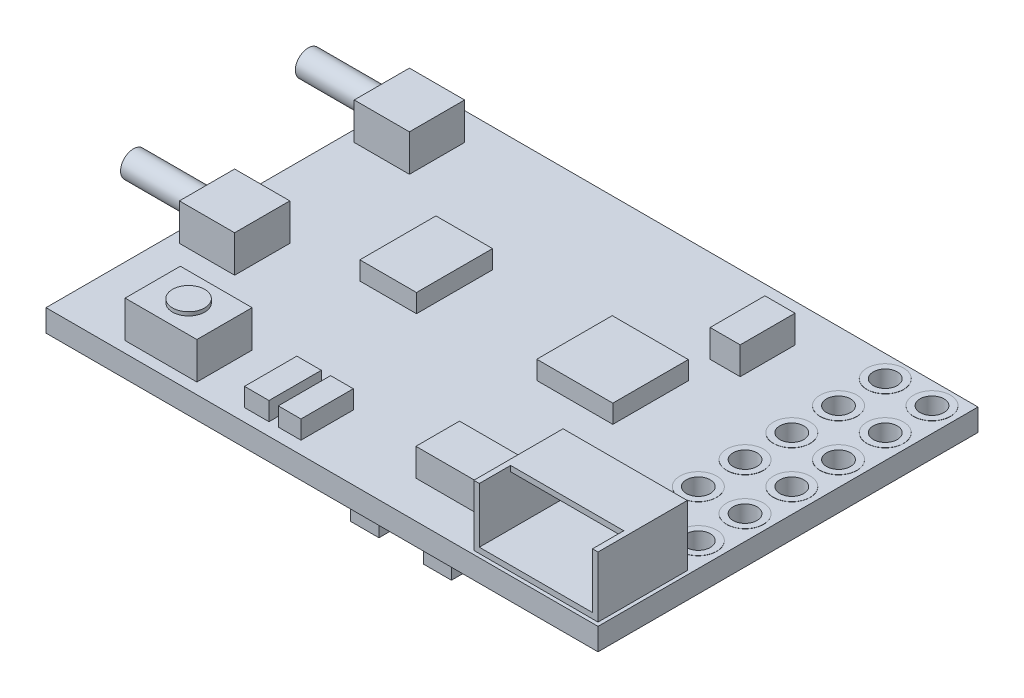
from build123d import *

# Parameters (mm, degrees)
SKETCH1_W            = 30
SKETCH1_H            = 20.65
BOSS_EXTRUDE1_DEPTH  = 1.2
CUT_EXTRUDE1_REACH   = 20.25
SKETCH2_R            = 0.65
SKETCH3_W            = 6.75
SKETCH3_H            = 4.85
BOSS_EXTRUDE2_DEPTH  = 3.3
SKETCH7_W            = 6.15
SKETCH7_H            = 1.7
CUT_EXTRUDE2_DEPTH   = 3
SKETCH8_W            = 6.15
SKETCH8_H            = 2.7
CUT_EXTRUDE3_DEPTH   = 2.85
SKETCH4_W            = 3
SKETCH4_H            = 3
BOSS_EXTRUDE3_DEPTH  = 2
SKETCH5_W            = 3.9
SKETCH5_H            = 3
BOSS_EXTRUDE4_DEPTH  = 2
SKETCH6_R            = 0.875
BOSS_EXTRUDE5_DEPTH  = 0.2
SKETCH9_W            = 4.13358082
SKETCH9_H            = 4.101537558
SKETCH9_W_2          = 3.076153169
SKETCH9_H_2          = 4.13358082
SKETCH9_W_3          = 1.33120833
SKETCH9_H_3          = 2.844230124
SKETCH9_W_4          = 1.23295523
BOSS_EXTRUDE6_DEPTH  = 1
SKETCH10_W           = 1.634206371
SKETCH10_H           = 2.980023382
SKETCH10_W_2         = 4.454013442
SKETCH10_H_2         = 2.371201401
BOSS_EXTRUDE7_DEPTH  = 1.5
SKETCH11_W           = 6.849678862
SKETCH11_H           = 6.849678863
SKETCH11_W_2         = 1.518707079
SKETCH11_H_2         = 3.006420134
SKETCH11_W_3         = 1.5497011
SKETCH11_H_3         = 3.068408178
SKETCH11_W_4         = 1.177772837
SKETCH11_H_4         = 2.758467958
SKETCH11_W_5         = 2.86022906
SKETCH11_H_5         = 4.18419297
SKETCH11_W_6         = 2.386539694
SKETCH11_H_6         = 3.0994022
SKETCH11_W_7         = 1.270754903
SKETCH11_H_7         = 3.161390244
BOSS_EXTRUDE8_DEPTH  = 1.5
BOSS_EXTRUDE9_START  = 0.01
SKETCH12_R           = 1
SKETCH12_R_2         = 0.65
BOSS_EXTRUDE9_DEPTH  = 0.01
SKETCH13_R           = 0.7
BOSS_EXTRUDE10_DEPTH = 4


with BuildPart() as part:
    # Sketch1 → Boss-Extrude1 (new body)
    with BuildSketch(Plane(origin=(0, 0, 0), x_dir=(1, 0, 0), z_dir=(0, 1, 0))):
        Rectangle(SKETCH1_W, SKETCH1_H)
    extrude(amount=BOSS_EXTRUDE1_DEPTH)

    # Sketch2 → Cut-Extrude1 (cut, up to next)
    with BuildSketch(Plane(origin=(0, 1.2, 0), x_dir=(1, 0, 0), z_dir=(0, 1, 0)), mode=Mode.PRIVATE) as cut_extrude1_sk1:
        with Locations(Location((13.7, 9.125, 0), (0, 0, 270))):
            Circle(SKETCH2_R)
    cut_extrude1_tool1 = extrude(cut_extrude1_sk1.sketch, amount=-CUT_EXTRUDE1_REACH, mode=Mode.PRIVATE) & part.part
    # Sketch2 → Cut-Extrude1 (cut, up to next)
    with BuildSketch(Plane(origin=(0, 1.2, 0), x_dir=(1, 0, 0), z_dir=(0, 1, 0)), mode=Mode.PRIVATE) as cut_extrude1_sk2:
        with Locations(Location((11.16, 9.125, 0), (0, 0, 270))):
            Circle(SKETCH2_R)
    cut_extrude1_tool2 = extrude(cut_extrude1_sk2.sketch, amount=-CUT_EXTRUDE1_REACH, mode=Mode.PRIVATE) & part.part
    # Sketch2 → Cut-Extrude1 (cut, up to next)
    with BuildSketch(Plane(origin=(0, 1.2, 0), x_dir=(1, 0, 0), z_dir=(0, 1, 0)), mode=Mode.PRIVATE) as cut_extrude1_sk3:
        with Locations(Location((11.16, 6.585, 0), (0, 0, 270))):
            Circle(SKETCH2_R)
    cut_extrude1_tool3 = extrude(cut_extrude1_sk3.sketch, amount=-CUT_EXTRUDE1_REACH, mode=Mode.PRIVATE) & part.part
    # Sketch2 → Cut-Extrude1 (cut, up to next)
    with BuildSketch(Plane(origin=(0, 1.2, 0), x_dir=(1, 0, 0), z_dir=(0, 1, 0)), mode=Mode.PRIVATE) as cut_extrude1_sk4:
        with Locations(Location((11.16, 4.045, 0), (0, 0, 270))):
            Circle(SKETCH2_R)
    cut_extrude1_tool4 = extrude(cut_extrude1_sk4.sketch, amount=-CUT_EXTRUDE1_REACH, mode=Mode.PRIVATE) & part.part
    # Sketch2 → Cut-Extrude1 (cut, up to next)
    with BuildSketch(Plane(origin=(0, 1.2, 0), x_dir=(1, 0, 0), z_dir=(0, 1, 0)), mode=Mode.PRIVATE) as cut_extrude1_sk5:
        with Locations(Location((11.16, 1.505, 0), (0, 0, 270))):
            Circle(SKETCH2_R)
    cut_extrude1_tool5 = extrude(cut_extrude1_sk5.sketch, amount=-CUT_EXTRUDE1_REACH, mode=Mode.PRIVATE) & part.part
    # Sketch2 → Cut-Extrude1 (cut, up to next)
    with BuildSketch(Plane(origin=(0, 1.2, 0), x_dir=(1, 0, 0), z_dir=(0, 1, 0)), mode=Mode.PRIVATE) as cut_extrude1_sk6:
        with Locations(Location((11.16, -1.035, 0), (0, 0, 270))):
            Circle(SKETCH2_R)
    cut_extrude1_tool6 = extrude(cut_extrude1_sk6.sketch, amount=-CUT_EXTRUDE1_REACH, mode=Mode.PRIVATE) & part.part
    # Sketch2 → Cut-Extrude1 (cut, up to next)
    with BuildSketch(Plane(origin=(0, 1.2, 0), x_dir=(1, 0, 0), z_dir=(0, 1, 0)), mode=Mode.PRIVATE) as cut_extrude1_sk7:
        with Locations(Location((11.16, -3.575, 0), (0, 0, 270))):
            Circle(SKETCH2_R)
    cut_extrude1_tool7 = extrude(cut_extrude1_sk7.sketch, amount=-CUT_EXTRUDE1_REACH, mode=Mode.PRIVATE) & part.part
    # Sketch2 → Cut-Extrude1 (cut, up to next)
    with BuildSketch(Plane(origin=(0, 1.2, 0), x_dir=(1, 0, 0), z_dir=(0, 1, 0)), mode=Mode.PRIVATE) as cut_extrude1_sk8:
        with Locations(Location((13.7, 6.585, 0), (0, 0, 270))):
            Circle(SKETCH2_R)
    cut_extrude1_tool8 = extrude(cut_extrude1_sk8.sketch, amount=-CUT_EXTRUDE1_REACH, mode=Mode.PRIVATE) & part.part
    # Sketch2 → Cut-Extrude1 (cut, up to next)
    with BuildSketch(Plane(origin=(0, 1.2, 0), x_dir=(1, 0, 0), z_dir=(0, 1, 0)), mode=Mode.PRIVATE) as cut_extrude1_sk9:
        with Locations(Location((13.7, 4.045, 0), (0, 0, 270))):
            Circle(SKETCH2_R)
    cut_extrude1_tool9 = extrude(cut_extrude1_sk9.sketch, amount=-CUT_EXTRUDE1_REACH, mode=Mode.PRIVATE) & part.part
    # Sketch2 → Cut-Extrude1 (cut, up to next)
    with BuildSketch(Plane(origin=(0, 1.2, 0), x_dir=(1, 0, 0), z_dir=(0, 1, 0)), mode=Mode.PRIVATE) as cut_extrude1_sk10:
        with Locations(Location((13.7, 1.505, 0), (0, 0, 270))):
            Circle(SKETCH2_R)
    cut_extrude1_tool10 = extrude(cut_extrude1_sk10.sketch, amount=-CUT_EXTRUDE1_REACH, mode=Mode.PRIVATE) & part.part
    # Sketch2 → Cut-Extrude1 (cut, up to next)
    with BuildSketch(Plane(origin=(0, 1.2, 0), x_dir=(1, 0, 0), z_dir=(0, 1, 0)), mode=Mode.PRIVATE) as cut_extrude1_sk11:
        with Locations(Location((13.7, -1.035, 0), (0, 0, 270))):
            Circle(SKETCH2_R)
    cut_extrude1_tool11 = extrude(cut_extrude1_sk11.sketch, amount=-CUT_EXTRUDE1_REACH, mode=Mode.PRIVATE) & part.part
    # Sketch2 → Cut-Extrude1 (cut, up to next)
    with BuildSketch(Plane(origin=(0, 1.2, 0), x_dir=(1, 0, 0), z_dir=(0, 1, 0)), mode=Mode.PRIVATE) as cut_extrude1_sk12:
        with Locations(Location((13.7, -3.575, 0), (0, 0, 270))):
            Circle(SKETCH2_R)
    cut_extrude1_tool12 = extrude(cut_extrude1_sk12.sketch, amount=-CUT_EXTRUDE1_REACH, mode=Mode.PRIVATE) & part.part
    add(cut_extrude1_tool1.solids().sort_by_distance((13.7, 1.2, -9.125))[0], mode=Mode.SUBTRACT)
    add(cut_extrude1_tool2.solids().sort_by_distance((11.16, 1.2, -9.125))[0], mode=Mode.SUBTRACT)
    add(cut_extrude1_tool3.solids().sort_by_distance((11.16, 1.2, -6.585))[0], mode=Mode.SUBTRACT)
    add(cut_extrude1_tool4.solids().sort_by_distance((11.16, 1.2, -4.045))[0], mode=Mode.SUBTRACT)
    add(cut_extrude1_tool5.solids().sort_by_distance((11.16, 1.2, -1.505))[0], mode=Mode.SUBTRACT)
    add(cut_extrude1_tool6.solids().sort_by_distance((11.16, 1.2, 1.035))[0], mode=Mode.SUBTRACT)
    add(cut_extrude1_tool7.solids().sort_by_distance((11.16, 1.2, 3.575))[0], mode=Mode.SUBTRACT)
    add(cut_extrude1_tool8.solids().sort_by_distance((13.7, 1.2, -6.585))[0], mode=Mode.SUBTRACT)
    add(cut_extrude1_tool9.solids().sort_by_distance((13.7, 1.2, -4.045))[0], mode=Mode.SUBTRACT)
    add(cut_extrude1_tool10.solids().sort_by_distance((13.7, 1.2, -1.505))[0], mode=Mode.SUBTRACT)
    add(cut_extrude1_tool11.solids().sort_by_distance((13.7, 1.2, 1.035))[0], mode=Mode.SUBTRACT)
    add(cut_extrude1_tool12.solids().sort_by_distance((13.7, 1.2, 3.575))[0], mode=Mode.SUBTRACT)

    # Sketch3 → Boss-Extrude2 (add)
    with BuildSketch(Plane(origin=(0, 1.2, 0), x_dir=(1, 0, 0), z_dir=(0, 1, 0))):
        with Locations((11.425, -7.7)):
            Rectangle(SKETCH3_W, SKETCH3_H)
    extrude(amount=BOSS_EXTRUDE2_DEPTH)

    # Sketch7 → Cut-Extrude2 (cut)
    with BuildSketch(Plane(origin=(0, 4.5, 0), x_dir=(1, 0, 0), z_dir=(0, 1, 0))):
        with Locations((11.425, -9.275)):
            Rectangle(SKETCH7_W, SKETCH7_H)
    extrude(amount=-CUT_EXTRUDE2_DEPTH, mode=Mode.SUBTRACT)

    # Sketch8 → Cut-Extrude3 (cut)
    with BuildSketch(Plane.XY.offset(8.425)):
        with Locations((11.425, 2.85)):
            Rectangle(SKETCH8_W, SKETCH8_H)
    extrude(amount=-CUT_EXTRUDE3_DEPTH, mode=Mode.SUBTRACT)

    # Sketch4 → Boss-Extrude3 (add)
    with BuildSketch(Plane(origin=(0, 1.2, 0), x_dir=(1, 0, 0), z_dir=(0, 1, 0))):
        with Locations((-12.9, 7.325)):
            Rectangle(SKETCH4_W, SKETCH4_H)
        with Locations((-12.9, -2.175)):
            Rectangle(SKETCH4_W, SKETCH4_H)
    extrude(amount=BOSS_EXTRUDE3_DEPTH)

    # Sketch5 → Boss-Extrude4 (add)
    with BuildSketch(Plane(origin=(0, 1.2, 0), x_dir=(1, 0, 0), z_dir=(0, 1, 0))):
        with Locations((-9.35, -8.225)):
            Rectangle(SKETCH5_W, SKETCH5_H)
    extrude(amount=BOSS_EXTRUDE4_DEPTH)

    # Sketch6 → Boss-Extrude5 (add)
    with BuildSketch(Plane(origin=(0, 3.2, 0), x_dir=(1, 0, 0), z_dir=(0, 1, 0))):
        with Locations(Location((-9.35, -8.225, 0), (0, 0, 90))):
            Circle(SKETCH6_R)
    extrude(amount=BOSS_EXTRUDE5_DEPTH)

    # Sketch9 → Boss-Extrude6 (add)
    with BuildSketch(Plane(origin=(0, 1.2, 0), x_dir=(1, 0, 0), z_dir=(0, 1, 0))):
        with Locations((3.82916983, 1.634206371)):
            Rectangle(SKETCH9_W, SKETCH9_H)
        with Locations((-6.1843496, 1.522054953)):
            Rectangle(SKETCH9_W_2, SKETCH9_H_2)
        with Locations((-4.237222614, -8.213349425)):
            Rectangle(SKETCH9_W_3, SKETCH9_H_3)
        with Locations((-2.449488873, -8.213349425)):
            Rectangle(SKETCH9_W_4, SKETCH9_H_3)
    extrude(amount=BOSS_EXTRUDE6_DEPTH)

    # Sketch10 → Boss-Extrude7 (add)
    with BuildSketch(Plane(origin=(0, 1.2, 0), x_dir=(1, 0, 0), z_dir=(0, 1, 0))):
        with Locations((6.296501018, 6.77714995)):
            Rectangle(SKETCH10_W, SKETCH10_H)
        with Locations((5.30315989, -7.113604202)):
            Rectangle(SKETCH10_W_2, SKETCH10_H_2)
    extrude(amount=BOSS_EXTRUDE7_DEPTH)

    # Sketch11 → Boss-Extrude8 (add)
    with BuildSketch(Plane.XZ):
        with Locations((-2.928935079, -0.803882292)):
            Rectangle(SKETCH11_W, SKETCH11_H)
        with Locations((5.387348503, 7.936431913)):
            Rectangle(SKETCH11_W_2, SKETCH11_H_2)
        with Locations((1.404616675, 7.874443869)):
            Rectangle(SKETCH11_W_3, SKETCH11_H_3)
        with Locations((5.557815623, 4.248143295)):
            Rectangle(SKETCH11_W_4, SKETCH11_H_4)
        with Locations((-13.56988547, -6.475788318)):
            Rectangle(SKETCH11_W_5, SKETCH11_H_5)
        with Locations((-12.403220127, 2.249028876)):
            Rectangle(SKETCH11_W_6, SKETCH11_H_6)
        with Locations((-9.365805971, -7.886016319)):
            Rectangle(SKETCH11_W_7, SKETCH11_H_7)
    extrude(amount=BOSS_EXTRUDE8_DEPTH)

    # Sketch12 → Boss-Extrude9 (add)
    # profile 1 of 12: a face of its own
    with BuildSketch(Plane(origin=(0, 1.2, 0), x_dir=(1, 0, 0), z_dir=(0, 1, 0)).offset(BOSS_EXTRUDE9_START)):
        with Locations(Location((11.16, 9.125, 0), (0, 0, 90))):
            Circle(SKETCH12_R)
        with Locations(Location((11.16, 9.125, 0), (0, 0, 270))):
            Circle(SKETCH12_R_2, mode=Mode.SUBTRACT)
    # profile 2 of 12: a face of its own
    with BuildSketch(Plane(origin=(0, 1.2, 0), x_dir=(1, 0, 0), z_dir=(0, 1, 0)).offset(BOSS_EXTRUDE9_START)):
        with Locations(Location((13.7, 9.125, 0), (0, 0, 90))):
            Circle(SKETCH12_R)
        with Locations(Location((13.7, 9.125, 0), (0, 0, 270))):
            Circle(SKETCH12_R_2, mode=Mode.SUBTRACT)
    # profile 3 of 12: a face of its own
    with BuildSketch(Plane(origin=(0, 1.2, 0), x_dir=(1, 0, 0), z_dir=(0, 1, 0)).offset(BOSS_EXTRUDE9_START)):
        with Locations(Location((13.7, 6.585, 0), (0, 0, 90))):
            Circle(SKETCH12_R)
        with Locations(Location((13.7, 6.585, 0), (0, 0, 270))):
            Circle(SKETCH12_R_2, mode=Mode.SUBTRACT)
    # profile 4 of 12: a face of its own
    with BuildSketch(Plane(origin=(0, 1.2, 0), x_dir=(1, 0, 0), z_dir=(0, 1, 0)).offset(BOSS_EXTRUDE9_START)):
        with Locations(Location((11.16, 6.585, 0), (0, 0, 90))):
            Circle(SKETCH12_R)
        with Locations(Location((11.16, 6.585, 0), (0, 0, 270))):
            Circle(SKETCH12_R_2, mode=Mode.SUBTRACT)
    # profile 5 of 12: a face of its own
    with BuildSketch(Plane(origin=(0, 1.2, 0), x_dir=(1, 0, 0), z_dir=(0, 1, 0)).offset(BOSS_EXTRUDE9_START)):
        with Locations(Location((11.16, 4.045, 0), (0, 0, 90))):
            Circle(SKETCH12_R)
        with Locations(Location((11.16, 4.045, 0), (0, 0, 270))):
            Circle(SKETCH12_R_2, mode=Mode.SUBTRACT)
    # profile 6 of 12: a face of its own
    with BuildSketch(Plane(origin=(0, 1.2, 0), x_dir=(1, 0, 0), z_dir=(0, 1, 0)).offset(BOSS_EXTRUDE9_START)):
        with Locations(Location((13.7, 4.045, 0), (0, 0, 90))):
            Circle(SKETCH12_R)
        with Locations(Location((13.7, 4.045, 0), (0, 0, 270))):
            Circle(SKETCH12_R_2, mode=Mode.SUBTRACT)
    # profile 7 of 12: a face of its own
    with BuildSketch(Plane(origin=(0, 1.2, 0), x_dir=(1, 0, 0), z_dir=(0, 1, 0)).offset(BOSS_EXTRUDE9_START)):
        with Locations(Location((13.7, 1.505, 0), (0, 0, 90))):
            Circle(SKETCH12_R)
        with Locations(Location((13.7, 1.505, 0), (0, 0, 270))):
            Circle(SKETCH12_R_2, mode=Mode.SUBTRACT)
    # profile 8 of 12: a face of its own
    with BuildSketch(Plane(origin=(0, 1.2, 0), x_dir=(1, 0, 0), z_dir=(0, 1, 0)).offset(BOSS_EXTRUDE9_START)):
        with Locations(Location((11.16, 1.505, 0), (0, 0, 90))):
            Circle(SKETCH12_R)
        with Locations(Location((11.16, 1.505, 0), (0, 0, 270))):
            Circle(SKETCH12_R_2, mode=Mode.SUBTRACT)
    # profile 9 of 12: a face of its own
    with BuildSketch(Plane(origin=(0, 1.2, 0), x_dir=(1, 0, 0), z_dir=(0, 1, 0)).offset(BOSS_EXTRUDE9_START)):
        with Locations(Location((11.16, -1.035, 0), (0, 0, 90))):
            Circle(SKETCH12_R)
        with Locations(Location((11.16, -1.035, 0), (0, 0, 270))):
            Circle(SKETCH12_R_2, mode=Mode.SUBTRACT)
    # profile 10 of 12: a face of its own
    with BuildSketch(Plane(origin=(0, 1.2, 0), x_dir=(1, 0, 0), z_dir=(0, 1, 0)).offset(BOSS_EXTRUDE9_START)):
        with Locations(Location((11.16, -3.575, 0), (0, 0, 90))):
            Circle(SKETCH12_R)
        with Locations(Location((11.16, -3.575, 0), (0, 0, 270))):
            Circle(SKETCH12_R_2, mode=Mode.SUBTRACT)
    # profile 11 of 12: a face of its own
    with BuildSketch(Plane(origin=(0, 1.2, 0), x_dir=(1, 0, 0), z_dir=(0, 1, 0)).offset(BOSS_EXTRUDE9_START)):
        with Locations(Location((13.7, -3.575, 0), (0, 0, 90))):
            Circle(SKETCH12_R)
        with Locations(Location((13.7, -3.575, 0), (0, 0, 270))):
            Circle(SKETCH12_R_2, mode=Mode.SUBTRACT)
    # profile 12 of 12: a face of its own
    with BuildSketch(Plane(origin=(0, 1.2, 0), x_dir=(1, 0, 0), z_dir=(0, 1, 0)).offset(BOSS_EXTRUDE9_START)):
        with Locations(Location((13.7, -1.035, 0), (0, 0, 90))):
            Circle(SKETCH12_R)
        with Locations(Location((13.7, -1.035, 0), (0, 0, 270))):
            Circle(SKETCH12_R_2, mode=Mode.SUBTRACT)
    boss_extrude9 = extrude(amount=-BOSS_EXTRUDE9_DEPTH)

    # Mirror1: Boss-Extrude9 across plane
    add(boss_extrude9.mirror(Plane.ZX.offset(0.6)))

    # Sketch13 → Boss-Extrude10 (add)
    with BuildSketch(Plane.ZY.offset(14.4)):
        with Locations(Location((-7.325, 2.2, 0), (0, 0, 180))):
            Circle(SKETCH13_R)
        with Locations(Location((2.175, 2.2, 0), (0, 0, 180))):
            Circle(SKETCH13_R)
    extrude(amount=BOSS_EXTRUDE10_DEPTH)


solid = part.part
